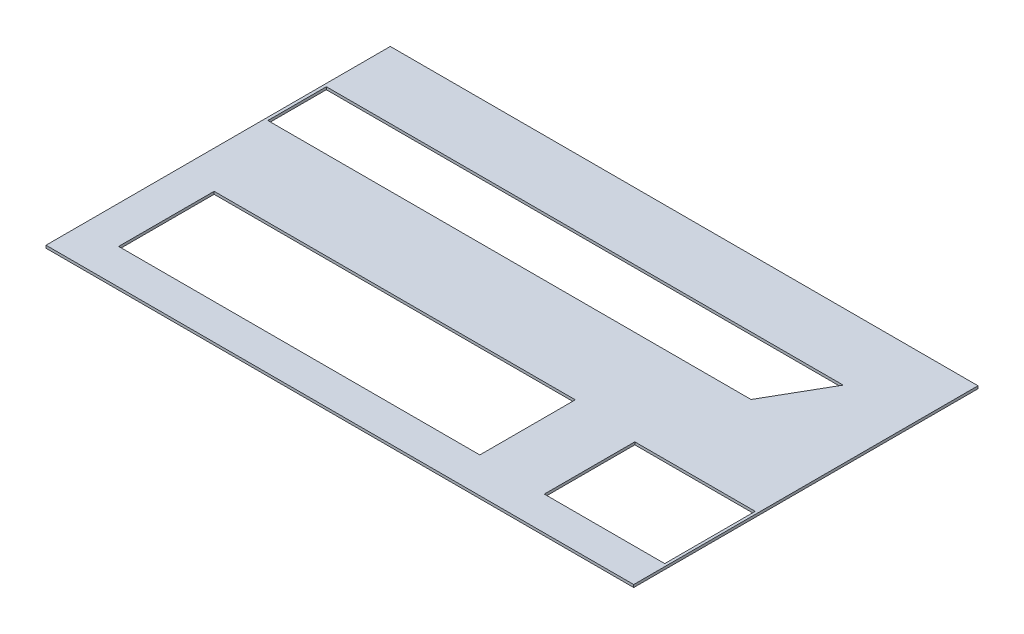
from build123d import *

# Parameters (mm, degrees)
SKETCH1_W           = 1415.68
SKETCH1_H           = 829.31
BOSS_EXTRUDE1_DEPTH = 6.35
CUT_EXTRUDE1_REACH  = 1642.715
SKETCH2_W           = 870
SKETCH2_H           = 230
SKETCH2_W_2         = 290
SKETCH2_H_2         = 218


with BuildPart() as part:
    # Sketch1 → Boss-Extrude1 (new body)
    with BuildSketch(Plane(origin=(0, 0, 0), x_dir=(1, 0, 0), z_dir=(0, 1, 0))):
        with Locations((707.84, 414.655)):
            Rectangle(SKETCH1_W, SKETCH1_H)
    extrude(amount=BOSS_EXTRUDE1_DEPTH)

    # Sketch2 → Cut-Extrude1 (cut, up to next)
    with BuildSketch(Plane(origin=(0, 6.35, 0), x_dir=(1, 0, 0), z_dir=(0, 1, 0)), mode=Mode.PRIVATE) as cut_extrude1_sk1:
        with Locations((525, 200)):
            Rectangle(SKETCH2_W, SKETCH2_H)
    cut_extrude1_tool1 = extrude(cut_extrude1_sk1.sketch, amount=-CUT_EXTRUDE1_REACH, mode=Mode.PRIVATE) & part.part
    # Sketch2 → Cut-Extrude1 (cut, up to next)
    with BuildSketch(Plane(origin=(0, 6.35, 0), x_dir=(1, 0, 0), z_dir=(0, 1, 0)), mode=Mode.PRIVATE) as cut_extrude1_sk2:
        Polygon((7, 668.31), (1252, 668.31), (1171, 527.31), (7, 527.31), align=None)
    cut_extrude1_tool2 = extrude(cut_extrude1_sk2.sketch, amount=-CUT_EXTRUDE1_REACH, mode=Mode.PRIVATE) & part.part
    # Sketch2 → Cut-Extrude1 (cut, up to next)
    with BuildSketch(Plane(origin=(0, 6.35, 0), x_dir=(1, 0, 0), z_dir=(0, 1, 0)), mode=Mode.PRIVATE) as cut_extrude1_sk3:
        with Locations((1264.33, 190)):
            Rectangle(SKETCH2_W_2, SKETCH2_H_2)
    cut_extrude1_tool3 = extrude(cut_extrude1_sk3.sketch, amount=-CUT_EXTRUDE1_REACH, mode=Mode.PRIVATE) & part.part
    add(cut_extrude1_tool1.solids().sort_by_distance((525, 6.35, -200))[0], mode=Mode.SUBTRACT)
    add(cut_extrude1_tool2.solids().sort_by_distance((609.476961, 6.35, -598.600162))[0], mode=Mode.SUBTRACT)
    add(cut_extrude1_tool3.solids().sort_by_distance((1264.33, 6.35, -190))[0], mode=Mode.SUBTRACT)


solid = part.part
